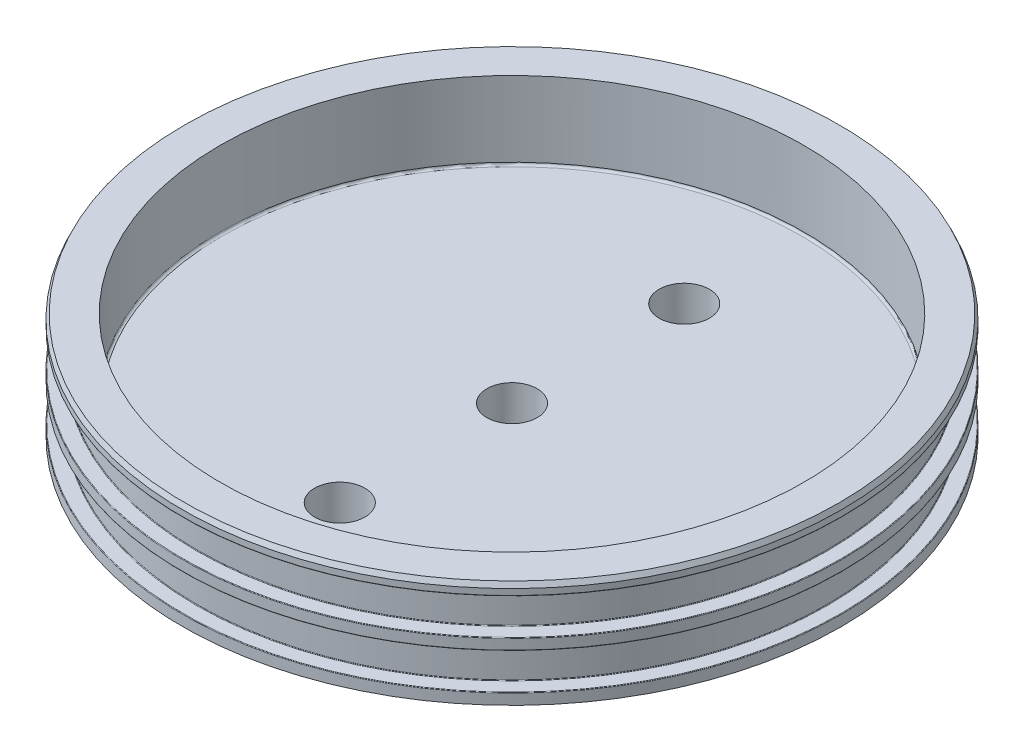
from build123d import *

# Parameters (mm, degrees)
SKETCH6_R                                = 66.04
BOSS_EXTRUDE1_DEPTH                      = 2.54
PIPE_TAP_DRILL_FOR_1_4_TAP_GN2_D         = 11.1252
CNC_ID_FILLET_R                          = 0.127
CNC_OD_FILLET_R                          = 0.127
CNC_CHAMFERS_SIZE                        = 0.508
CNC_CHAMFERS_SIZE2                       = 1.089409516
CNC_BORE_FILLET_R                        = 0.508
PIPE_TAP_DRILL_FOR_1_4_TAP_RELIEF_VALV_D = 11.1252
PIPE_TAP_DRILL_FOR_1_4_TAP_VENT_VALVE_D  = 11.1252


with BuildPart() as part:
    # Sketch1 → Revolve1 (revolve)
    with BuildSketch(Plane.XY, mode=Mode.PRIVATE) as revolve1_sk:
        Polygon((0, 0), (72.898, 0), (72.898, 2.4638), (69.6468, 2.4638), (69.6468, 10.4648), (72.898, 10.4648), (72.898, 12.9286), (69.6468, 12.9286), (69.6468, 20.9296), (72.898, 20.9296), (72.898, 23.4696), (64.5668, 23.4696), (64.5668, 6.35), (0, 6.35), align=None)
    revolve(revolve1_sk.sketch.rotate(Axis((0, 48.192213231, 0), (0, -1, 0)), 180), axis=Axis((0, 48.192213231, 0), (0, -1, 0)))

    # Sketch6 → Boss-Extrude1 (add)
    with BuildSketch(Plane.XZ):
        Circle(SKETCH6_R)
    extrude(amount=BOSS_EXTRUDE1_DEPTH)

    # Pipe Tap Drill for 1/4 Tap - GN2 (through all)
    with Locations(Plane(origin=(0, 6.35, 0), x_dir=(1, 0, 0), z_dir=(0, 1, 0))):
        with Locations((0, 0)):
            Hole(PIPE_TAP_DRILL_FOR_1_4_TAP_GN2_D / 2)

    # CNC ID Fillet
    cnc_id_fillet_edges = [part.edges().sort_by_distance(p)[0] for p in [
        (69.6468, 20.9296, 0),
        (69.6468, 12.9286, 0),
        (69.6468, 10.4648, 0),
        (69.6468, 2.4638, 0),
        (-66.04, 0, 0),
    ]]
    fillet(cnc_id_fillet_edges, radius=CNC_ID_FILLET_R)

    # CNC OD Fillet
    cnc_od_fillet_edges = [part.edges().sort_by_distance(p)[0] for p in [
        (72.898, 20.9296, 0),
        (72.898, 12.9286, 0),
        (72.898, 10.4648, 0),
        (72.898, 2.4638, 0),
        (-66.04, -2.54, 0),
    ]]
    fillet(cnc_od_fillet_edges, radius=CNC_OD_FILLET_R)

    # CNC Chamfers
    cnc_chamfers_edges = [part.edges().sort_by_distance(p)[0] for p in [
        (72.898, 23.4696, 0),
    ]]
    cnc_chamfers_side = [part.faces().sort_by_distance(p)[0] for p in [
        (70.836133195, 23.4696, 0),
    ]]
    chamfer(cnc_chamfers_edges, length=CNC_CHAMFERS_SIZE, length2=CNC_CHAMFERS_SIZE2, reference=cnc_chamfers_side[0])

    # CNC Bore Fillet
    cnc_bore_fillet_edges = [part.edges().sort_by_distance(p)[0] for p in [
        (64.5668, 6.35, 0),
    ]]
    fillet(cnc_bore_fillet_edges, radius=CNC_BORE_FILLET_R)

    # Pipe Tap Drill for 1/4 Tap - Relief Valve (through all)
    with Locations(Plane(origin=(0, -2.54, 0), x_dir=(-1, 0, 0), z_dir=(0, -1, 0))):
        with Locations((0, 38.1)):
            Hole(PIPE_TAP_DRILL_FOR_1_4_TAP_RELIEF_VALV_D / 2)

    # Pipe Tap Drill for 1/4 Tap - Vent Valve (through all)
    with Locations(Plane(origin=(0, -2.54, 0), x_dir=(-1, 0, 0), z_dir=(0, -1, 0))):
        with Locations((0, -38.1)):
            Hole(PIPE_TAP_DRILL_FOR_1_4_TAP_VENT_VALVE_D / 2)


solid = part.part
